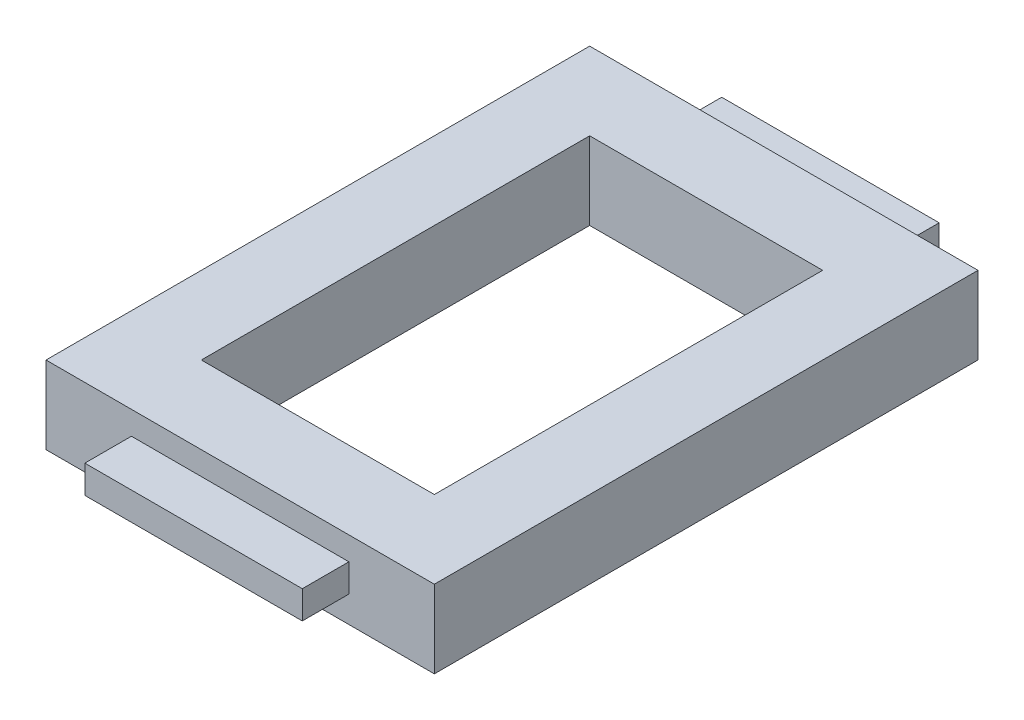
from build123d import *

# Parameters (mm, degrees)
SKETCH1_W           = 25
SKETCH1_H           = 35
SKETCH1_W_2         = 15
SKETCH1_H_2         = 25
BOSS_EXTRUDE1_DEPTH = 5
SKETCH2_W           = 14
SKETCH2_H           = 1.8
BOSS_EXTRUDE2_DEPTH = 3
SKETCH3_W           = 14
SKETCH3_H           = 1.8
BOSS_EXTRUDE3_DEPTH = 3


with BuildPart() as part:
    # Sketch1 → Boss-Extrude1 (new body)
    with BuildSketch(Plane(origin=(0, 0, 0), x_dir=(1, 0, 0), z_dir=(0, 1, 0))):
        with Locations((12.5, 17.5)):
            Rectangle(SKETCH1_W, SKETCH1_H)
        with Locations((12.5, 17.5)):
            Rectangle(SKETCH1_W_2, SKETCH1_H_2, mode=Mode.SUBTRACT)
    extrude(amount=BOSS_EXTRUDE1_DEPTH)

    # Sketch2 → Boss-Extrude2 (add)
    with BuildSketch(Plane.XY):
        with Locations((12.5, 2.6)):
            Rectangle(SKETCH2_W, SKETCH2_H)
    extrude(amount=BOSS_EXTRUDE2_DEPTH)

    # Sketch3 → Boss-Extrude3 (add)
    with BuildSketch(Plane(origin=(0, 0, -35), x_dir=(-1, 0, 0), z_dir=(0, 0, -1))):
        with Locations((-12.5, 2.5)):
            Rectangle(SKETCH3_W, SKETCH3_H)
    extrude(amount=BOSS_EXTRUDE3_DEPTH)


solid = part.part
